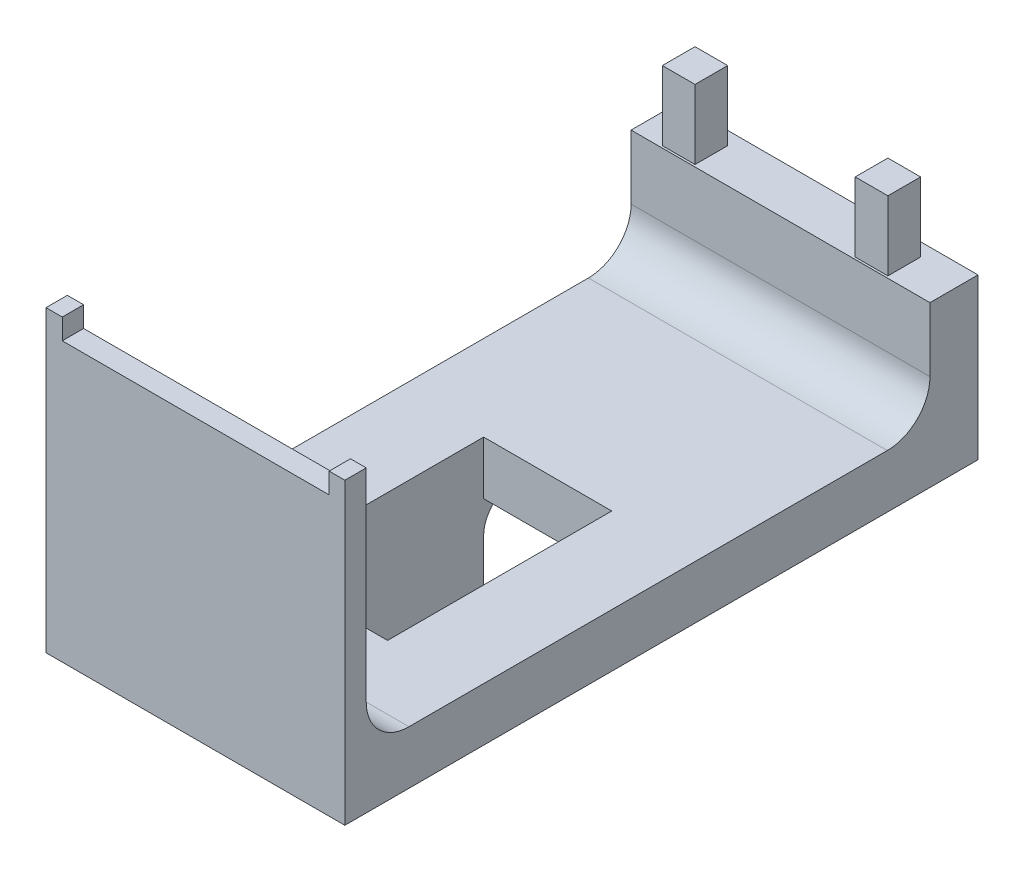
from build123d import *

# Parameters (mm, degrees)
SKETCH1_W           = 27.99800038
SKETCH1_H           = 4.5
BOSS_EXTRUDE2_DEPTH = 15
SKETCH2_W           = 27.99800038
SKETCH2_H           = 5
BOSS_EXTRUDE3_DEPTH = 52.81000038
FILLET1_R           = 4
SKETCH3_W           = 27.99800038
SKETCH3_H           = 5
BOSS_EXTRUDE4_DEPTH = 2.000000002
FILLET2_R           = 4
SKETCH4_W           = 3.06400013
SKETCH4_H           = 3.062000231
SKETCH4_W_2         = 3.062003374
BOSS_EXTRUDE5_DEPTH = 6.5
SKETCH5_W           = 12
SKETCH5_H           = 21
CUT_EXTRUDE1_DEPTH  = 6.5
SKETCH6_W           = 3
SKETCH6_H           = 21
BOSS_EXTRUDE6_DEPTH = 12.2
CUT_EXTRUDE2_DEPTH  = 12.2
FILLET4_R           = 3
FILLET5_R           = 3


with BuildPart() as part:
    # Sketch1 → Boss-Extrude2 (new body)
    with BuildSketch(Plane(origin=(0, 0, 0), x_dir=(1, 0, 0), z_dir=(0, 1, 0))):
        with Locations((13.99900019, 2.25)):
            Rectangle(SKETCH1_W, SKETCH1_H)
    extrude(amount=BOSS_EXTRUDE2_DEPTH)

    # Sketch2 → Boss-Extrude3 (add)
    with BuildSketch(Plane.XY):
        with Locations((13.99900019, 2.5)):
            Rectangle(SKETCH2_W, SKETCH2_H)
    extrude(amount=BOSS_EXTRUDE3_DEPTH)

    # Fillet1
    fillet1_edges = [part.edges().sort_by_distance(p)[0] for p in [
        (13.99900019, 5, 0),
    ]]
    fillet(fillet1_edges, radius=FILLET1_R)

    # Sketch3 → Boss-Extrude4 (add)
    with BuildSketch(Plane.XY.offset(52.81000038)):
        Polygon((0, 5), (27.99800038, 5), (27.99800038, 28), (26.52400061, 28), (26.52400061, 26.06971172), (1.52400061, 26.06971172), (1.52400061, 28), (0, 28), align=None)
        with Locations((13.99900019, 2.5)):
            Rectangle(SKETCH3_W, SKETCH3_H)
    extrude(amount=BOSS_EXTRUDE4_DEPTH)

    # Fillet2
    fillet2_edges = [part.edges().sort_by_distance(p)[0] for p in [
        (13.99900019, 5, 52.81000038),
    ]]
    fillet(fillet2_edges, radius=FILLET2_R)

    # Sketch4 → Boss-Extrude5 (add)
    with BuildSketch(Plane(origin=(0, 15, 0), x_dir=(1, 0, 0), z_dir=(0, 1, 0))):
        with Locations((22.327996787, 1.728999914)):
            Rectangle(SKETCH4_W, SKETCH4_H)
        with Locations((4.258997735, 1.728999914)):
            Rectangle(SKETCH4_W_2, SKETCH4_H)
    extrude(amount=BOSS_EXTRUDE5_DEPTH)

    # Sketch5 → Cut-Extrude1 (cut)
    with BuildSketch(Plane.XZ):
        with Locations((13.99800038, 32.310000382)):
            Rectangle(SKETCH5_W, SKETCH5_H)
    extrude(amount=-CUT_EXTRUDE1_DEPTH, mode=Mode.SUBTRACT)

    # Sketch6 → Boss-Extrude6 (add)
    with BuildSketch(Plane.XZ):
        with Locations((6.49800038, 32.310000382)):
            Rectangle(SKETCH6_W, SKETCH6_H)
    extrude(amount=BOSS_EXTRUDE6_DEPTH)

    # Sketch7 → Cut-Extrude2 (cut)
    with BuildSketch(Plane.ZY.offset(-4.99800038)):
        with BuildLine():
            ThreePointArc((24.810000382, -7.65), (23.260000382, -9.2), (24.810000382, -10.75))
            ThreePointArc((24.810000382, -10.75), (26.360000382, -9.2), (24.810000382, -7.65))
        make_face()
        with BuildLine():
            ThreePointArc((39.810000382, -7.65), (38.260000382, -9.2), (39.810000382, -10.75))
            ThreePointArc((39.810000382, -10.75), (41.360000382, -9.2), (39.810000382, -7.65))
        make_face()
    extrude(amount=-CUT_EXTRUDE2_DEPTH, mode=Mode.SUBTRACT)

    # Fillet4
    fillet4_edges = [part.edges().sort_by_distance(p)[0] for p in [
        (6.49800038, -12.2, 42.810000382),
        (6.49800038, -12.2, 21.810000382),
    ]]
    fillet(fillet4_edges, radius=FILLET4_R)

    # Fillet5
    fillet5_edges = [part.edges().sort_by_distance(p)[0] for p in [
        (6.49800038, 0, 42.810000382),
        (6.49800038, 0, 21.810000382),
    ]]
    fillet(fillet5_edges, radius=FILLET5_R)


solid = part.part
